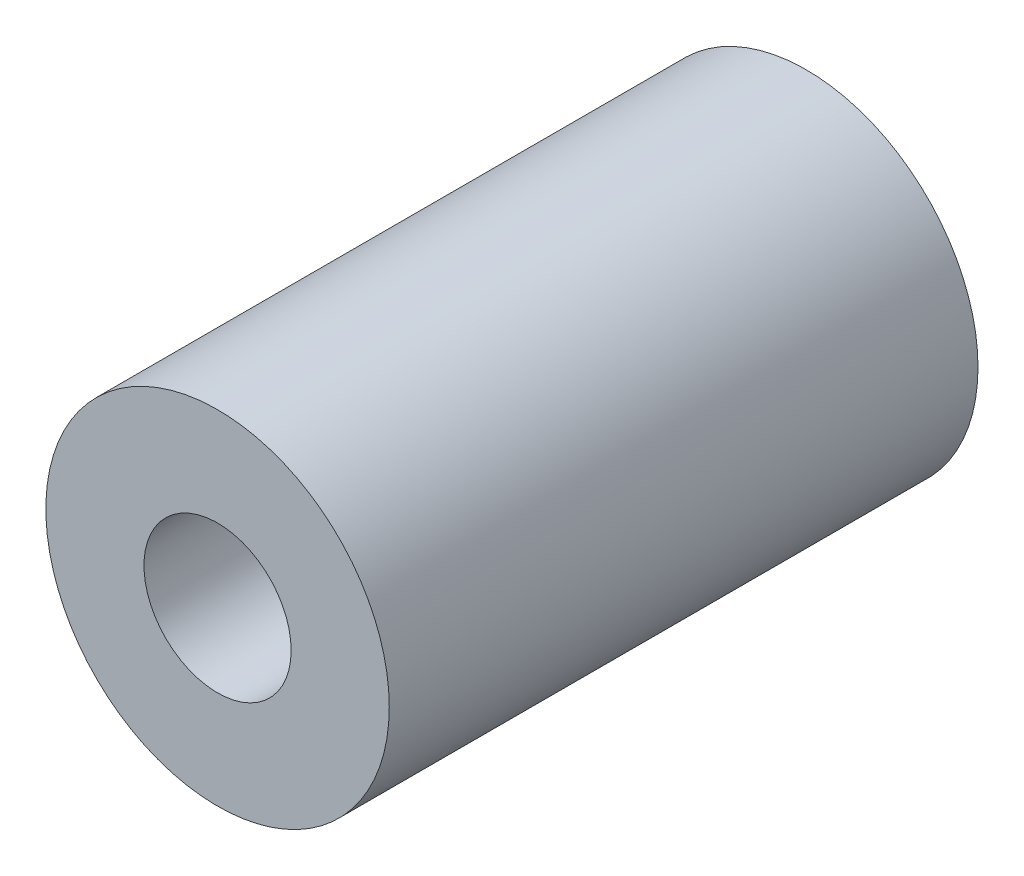
from build123d import *

# Parameters (mm, degrees)
ESQUISSE1_R        = 3.5
ESQUISSE1_R_2      = 1.5
BOSS_EXTRU_1_DEPTH = 12


with BuildPart() as part:
    # Esquisse1 → Boss.-Extru.1 (new body)
    with BuildSketch(Plane.XY):
        Circle(ESQUISSE1_R)
        Circle(ESQUISSE1_R_2, mode=Mode.SUBTRACT)
    extrude(amount=BOSS_EXTRU_1_DEPTH)


solid = part.part
